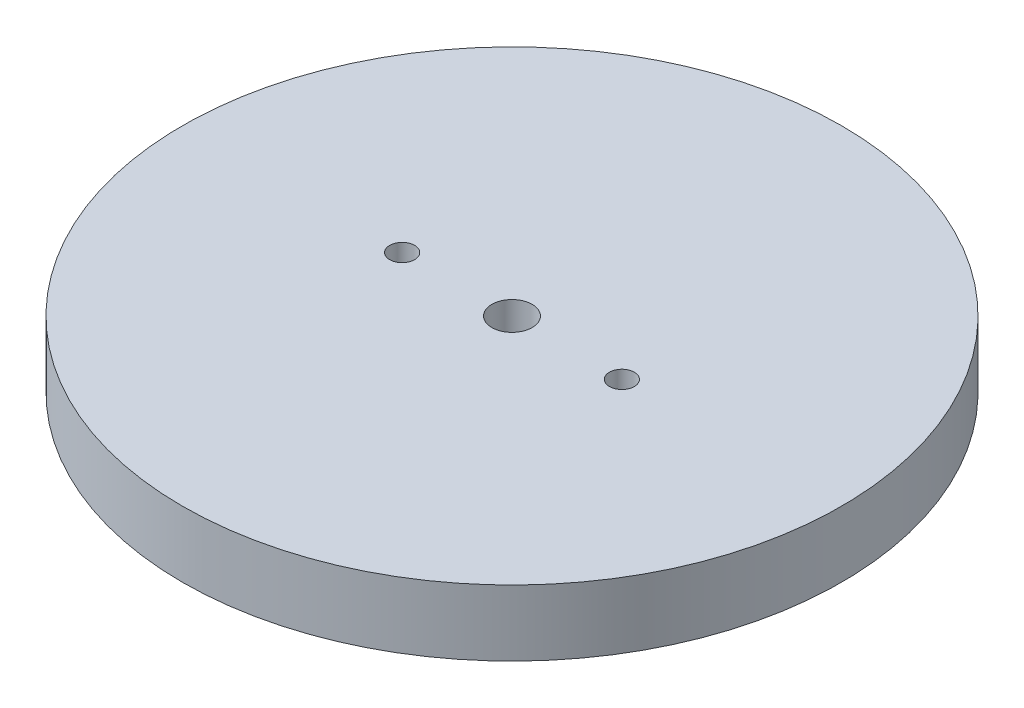
from build123d import *

# Parameters (mm, degrees)
SKETCH1_R           = 45
SKETCH1_R_2         = 2.75
SKETCH1_R_3         = 1.7
BOSS_EXTRUDE1_DEPTH = 9


with BuildPart() as part:
    # Sketch1 → Boss-Extrude1 (new body)
    with BuildSketch(Plane(origin=(0, 0, 0), x_dir=(1, 0, 0), z_dir=(0, 1, 0))):
        with Locations(Location((-24.48350584, -19.145341983, 0), (0, 0, 270))):
            Circle(SKETCH1_R)
        with Locations(Location((-24.48350584, -19.145341983, 0), (0, 0, 270))):
            Circle(SKETCH1_R_2, mode=Mode.SUBTRACT)
        with Locations(Location((-39.48350584, -19.145341983, 0), (0, 0, 270))):
            Circle(SKETCH1_R_3, mode=Mode.SUBTRACT)
        with Locations(Location((-9.48350584, -19.145341983, 0), (0, 0, 270))):
            Circle(SKETCH1_R_3, mode=Mode.SUBTRACT)
    extrude(amount=BOSS_EXTRUDE1_DEPTH)


solid = part.part
